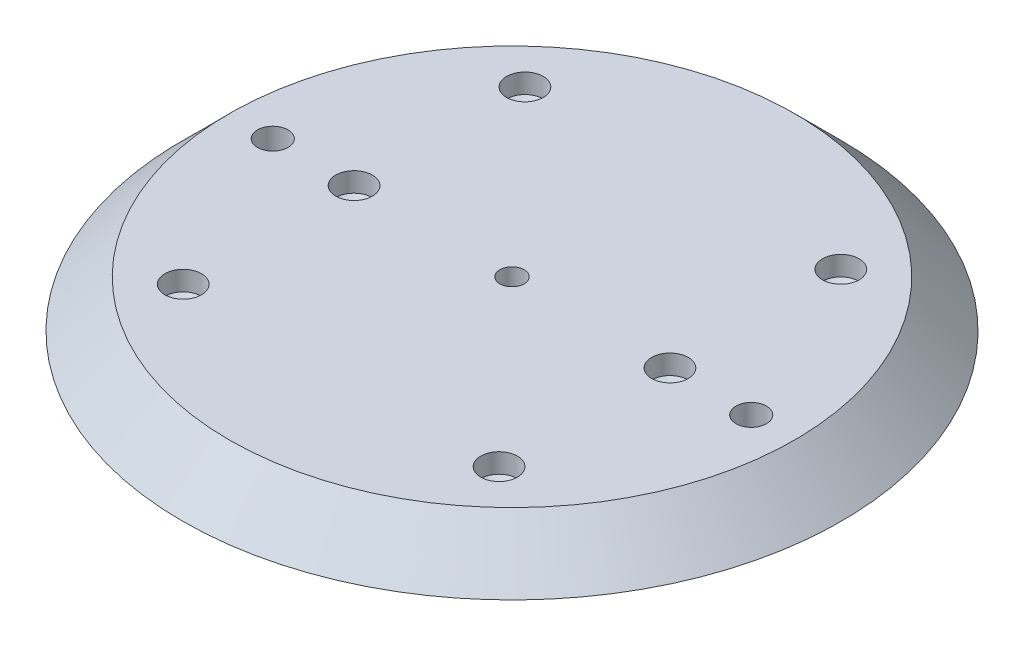
from build123d import *

# Parameters (mm, degrees)
SKETCH1_R                        = 85.725
BOSS_EXTRUDE1_DEPTH              = 12.192
BOSS_EXTRUDE1_TAPER              = 45
F_3_8_16_TAPPED_HOLE1_D          = 7.9375
F_1_4_0_25_PRESS_DOWEL_HOLE1_D   = 6.35
F_3_8_0_375_DIAMETER_HOLE1_D     = 9.525
F_3_8_0_375_DIAMETER_HOLE1_DEPTH = 5.08
F_3_8_0_375_DIAMETER_HOLE1_TIP   = 2.861598698


with BuildPart() as part:
    # Sketch1 → Boss-Extrude1 (new body)
    with BuildSketch(Plane(origin=(0, 0, 0), x_dir=(1, 0, 0), z_dir=(0, 1, 0))):
        Circle(SKETCH1_R)
    extrude(amount=BOSS_EXTRUDE1_DEPTH, taper=BOSS_EXTRUDE1_TAPER)

    # 3/8-16 Tapped Hole1 (through all)
    with Locations(Plane(origin=(0, 12.192, 0), x_dir=(-0.9997060077974085, 0, -0.024246607469250836), z_dir=(0, 1, 0))):
        with Locations((62.211704865, 1.508866383), (-62.211704865, -1.508866383)):
            Hole(F_3_8_16_TAPPED_HOLE1_D / 2)

    # 1/4 (0.25) Press Dowel Hole1 (through all)
    with Locations(Plane(origin=(-177.991498203, 12.192, 193.466008664), x_dir=(-0.909586317376337, 0, -0.4155150192733753), z_dir=(0, 1, 0))):
        with Locations((-81.510599056, -249.932175164)):
            Hole(F_1_4_0_25_PRESS_DOWEL_HOLE1_D / 2)

    # 3/8 (0.375) Diameter Hole1
    with Locations(Plane(origin=(0, 12.192, 0), x_dir=(1, 0, 0), z_dir=(0, 1, 0))):
        with Locations((-41.0845, 44.45), (-41.0845, 0), (-41.0845, -44.45), (41.0845, -44.45), (41.0845, 0), (41.0845, 44.45)):
            Hole(F_3_8_0_375_DIAMETER_HOLE1_D / 2, depth=F_3_8_0_375_DIAMETER_HOLE1_DEPTH)
            with Locations((0, 0, -(F_3_8_0_375_DIAMETER_HOLE1_DEPTH + F_3_8_0_375_DIAMETER_HOLE1_TIP / 2))):  # 118° drill point
                Cone(0, F_3_8_0_375_DIAMETER_HOLE1_D / 2, F_3_8_0_375_DIAMETER_HOLE1_TIP, mode=Mode.SUBTRACT)


solid = part.part
